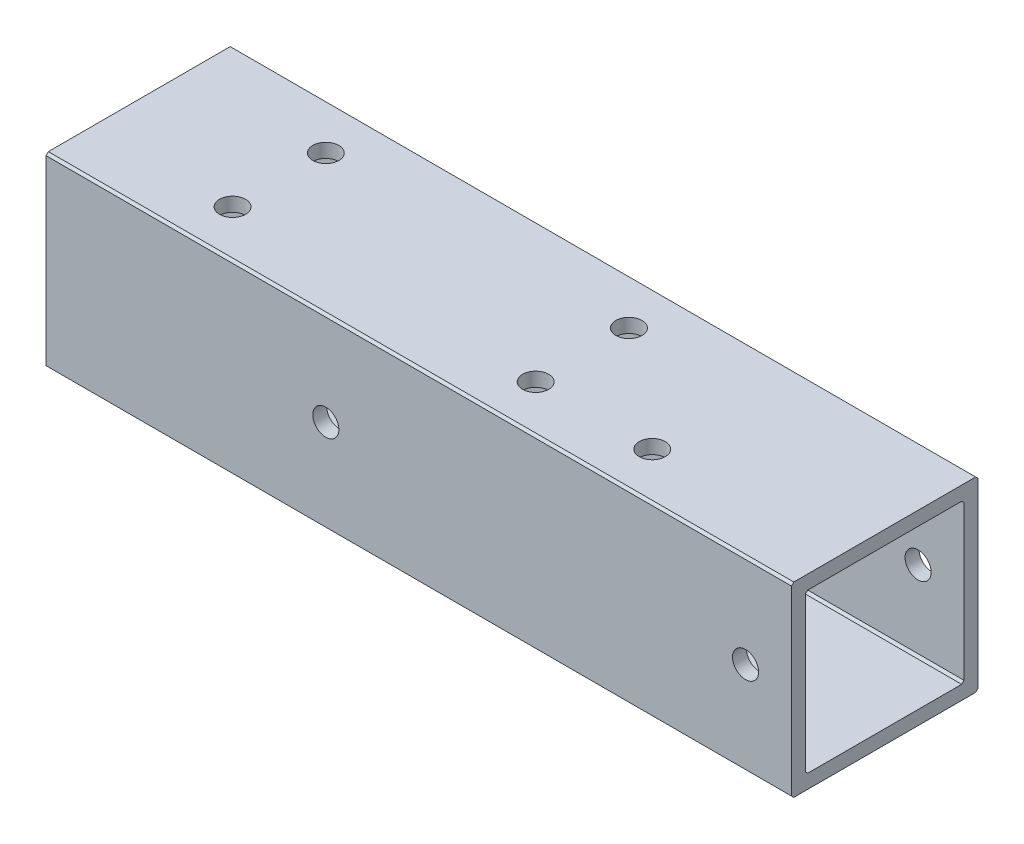
from build123d import *

# Parameters (mm, degrees)
SKETCH1_W                      = 159.85
SKETCH1_H                      = 40
BOSS_EXTRUDE1_DEPTH            = 40
SKETCH2_W                      = 34
SKETCH2_H                      = 34
CUT_EXTRUDE1_DEPTH             = 256.569995305
F_5_6_5_6_DIAMETER_HOLE1_D     = 5.6
F_5_6_5_6_DIAMETER_HOLE1_DEPTH = 3
F_5_6_5_6_DIAMETER_HOLE2_D     = 5.6
F_5_6_5_6_DIAMETER_HOLE2_DEPTH = 3
F_5_6_5_6_DIAMETER_HOLE3_D     = 5.6
F_5_6_5_6_DIAMETER_HOLE4_D     = 5.6
F_5_6_5_6_DIAMETER_HOLE4_DEPTH = 40
CHAMFER1_SIZE                  = 0.5


with BuildPart() as part:
    # Sketch1 → Boss-Extrude1 (new body)
    with BuildSketch(Plane(origin=(0, -102, 0), x_dir=(1, 0, 0), z_dir=(0, 1, 0))):
        with Locations((-170.075, -120)):
            Rectangle(SKETCH1_W, SKETCH1_H)
    extrude(amount=-BOSS_EXTRUDE1_DEPTH)

    # Sketch2 → Cut-Extrude1 (cut, through all)
    with BuildSketch(Plane.ZY.offset(250)):
        with Locations((120, -122)):
            Rectangle(SKETCH2_W, SKETCH2_H)
    extrude(amount=-CUT_EXTRUDE1_DEPTH, mode=Mode.SUBTRACT)

    # Ø5.6 (5.6) Diameter Hole1
    with Locations(Plane(origin=(0, -139, 0), x_dir=(1, 0, 0), z_dir=(0, 1, 0))):
        with Locations((-130, -130), (-155, -130), (-155, -110), (-220, -130), (-220, -110)):
            Hole(F_5_6_5_6_DIAMETER_HOLE1_D / 2, depth=F_5_6_5_6_DIAMETER_HOLE1_DEPTH)

    # Ø5.6 (5.6) Diameter Hole2
    with Locations(Plane(origin=(0, 0, 100), x_dir=(-1, 0, 0), z_dir=(0, 0, -1))):
        with Locations((100, -122), (190, -122)):
            Hole(F_5_6_5_6_DIAMETER_HOLE2_D / 2, depth=F_5_6_5_6_DIAMETER_HOLE2_DEPTH)

    # Ø5.6 (5.6) Diameter Hole3 (through all)
    with Locations(Plane(origin=(0, 0, 137), x_dir=(-1, 0, 0), z_dir=(0, 0, -1))):
        with Locations((100, -122), (190, -122)):
            Hole(F_5_6_5_6_DIAMETER_HOLE3_D / 2)

    # Ø5.6 (5.6) Diameter Hole4
    with Locations(Plane(origin=(0, -102, 0), x_dir=(1, 0, 0), z_dir=(0, 1, 0))):
        with Locations((-130, -130), (-155, -130), (-155, -110), (-220, -130), (-220, -110)):
            Hole(F_5_6_5_6_DIAMETER_HOLE4_D / 2, depth=F_5_6_5_6_DIAMETER_HOLE4_DEPTH)

    # Chamfer1
    chamfer1_edges = [part.edges().sort_by_distance(p)[0] for p in [
        (-170.075, -142, 100),
        (-170.075, -139, 103),
        (-170.075, -105, 103),
        (-170.075, -105, 137),
        (-170.075, -139, 137),
        (-170.075, -142, 140),
        (-170.075, -102, 100),
        (-170.075, -102, 140),
    ]]
    chamfer(chamfer1_edges, length=CHAMFER1_SIZE)


solid = part.part
